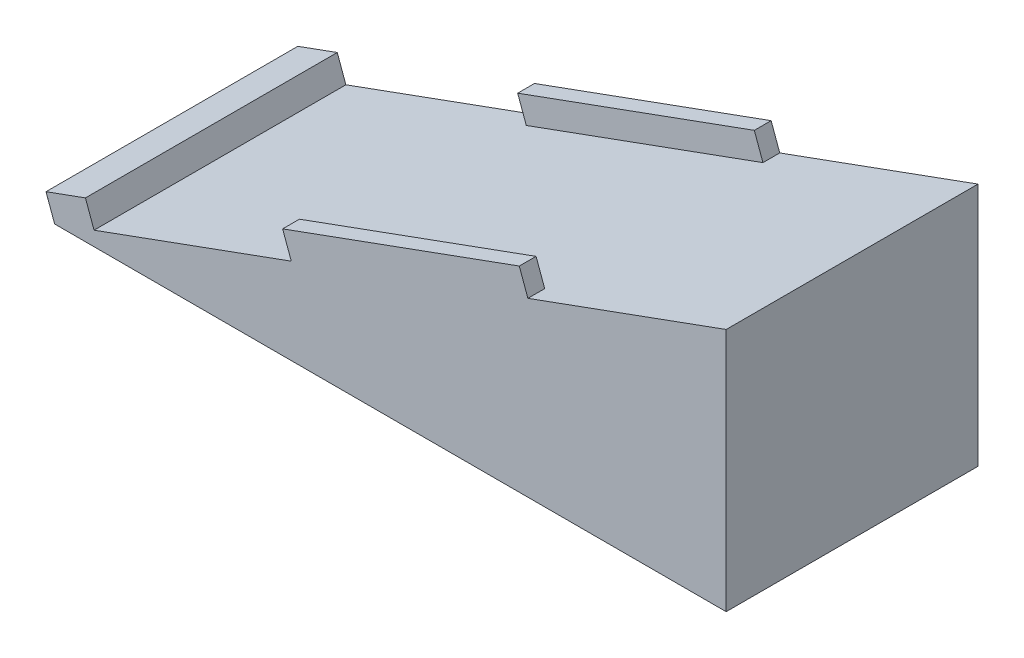
from build123d import *

# Parameters (mm, degrees)
BOSS_EXTRUDE1_DEPTH = 30
SKETCH2_W           = 5
SKETCH2_H           = 30
SKETCH2_W_2         = 30
SKETCH2_H_2         = 2
BOSS_EXTRUDE2_DEPTH = 3


with BuildPart() as part:
    # Sketch1 → Boss-Extrude1 (new body)
    with BuildSketch(Plane.XY):
        Polygon((0, 0), (80, 0), (80, 29.117618741), align=None)
    extrude(amount=BOSS_EXTRUDE1_DEPTH)

    # Sketch2 → Boss-Extrude2 (add)
    with BuildSketch(Plane(origin=(0, 0, 0), x_dir=(0.9396926207859082, 0.34202014332566943, 0), z_dir=(-0.34202014332566943, 0.9396926207859082, 0))):
        with Locations((2.5, -15)):
            Rectangle(SKETCH2_W, SKETCH2_H)
        with Locations((45, -1)):
            Rectangle(SKETCH2_W_2, SKETCH2_H_2)
        with Locations((45, -29)):
            Rectangle(SKETCH2_W_2, SKETCH2_H_2)
    extrude(amount=BOSS_EXTRUDE2_DEPTH)


solid = part.part
